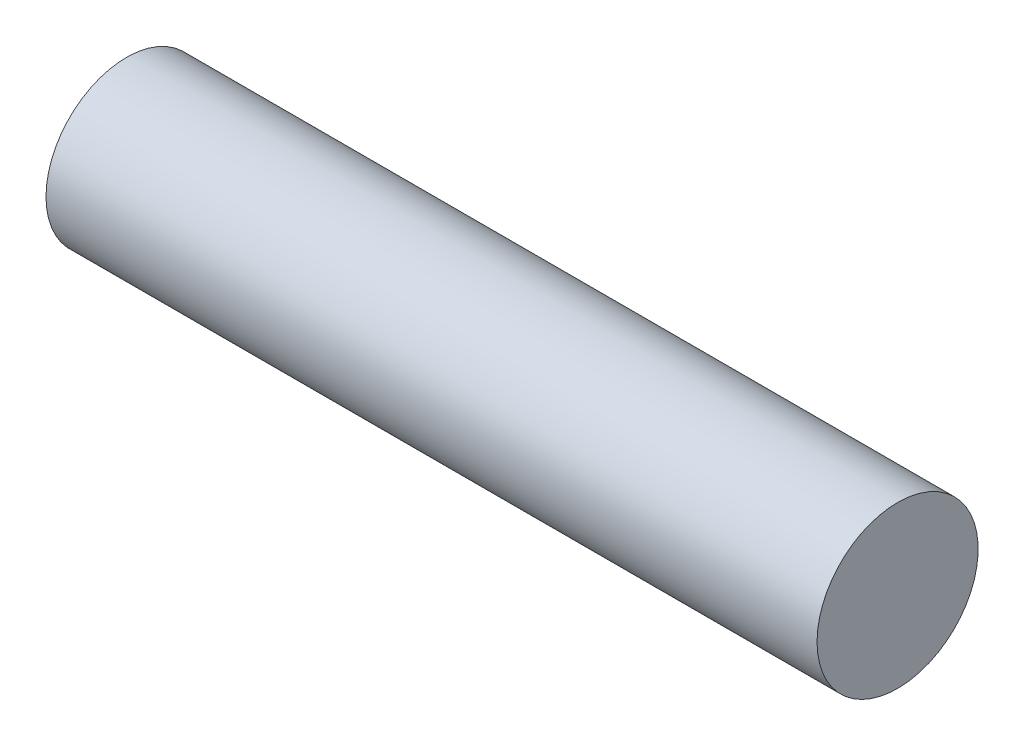
from build123d import *

# Parameters (mm, degrees)
SKETCH1_W = 67
SKETCH1_H = 7


with BuildPart() as part:
    # Sketch1 → Revolve2 (revolve)
    with BuildSketch(Plane(origin=(0, 0, 0), x_dir=(1, 0, 0), z_dir=(0, 1, 0))):
        with Locations((0, -3.5)):
            Rectangle(SKETCH1_W, SKETCH1_H)
    revolve(axis=Axis((-33.5, 0, 0), (1, 0, 0)))


solid = part.part
